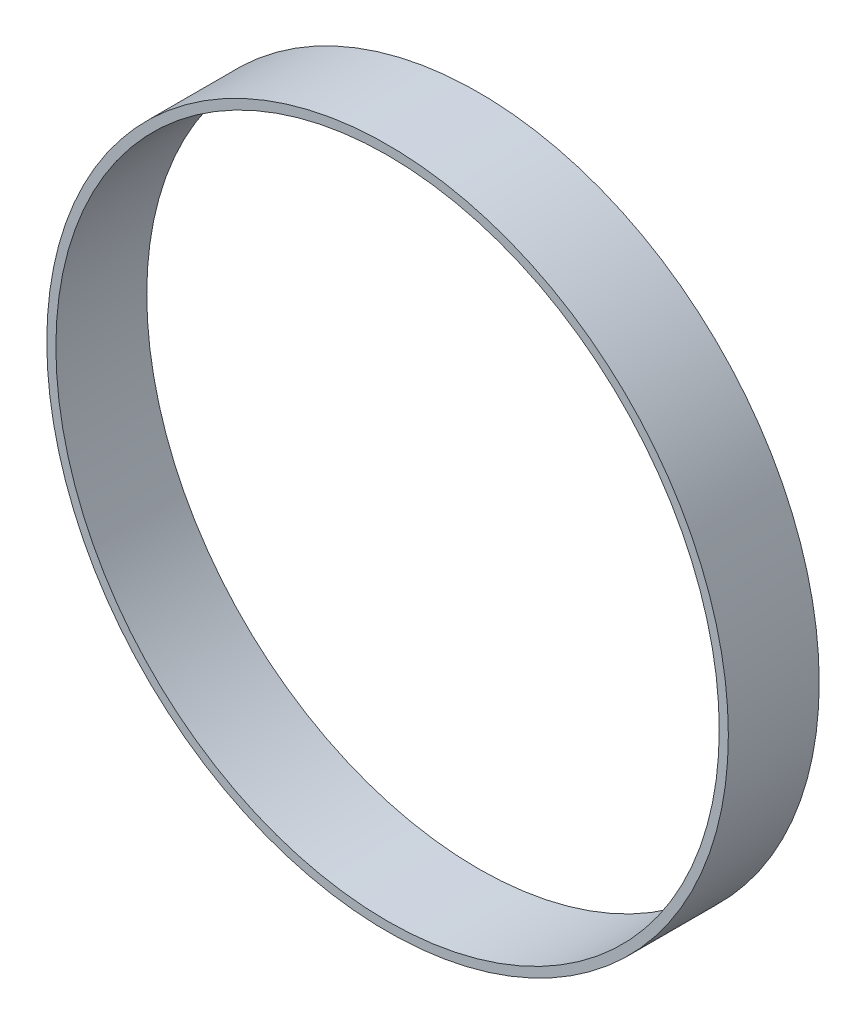
from build123d import *

# Parameters (mm, degrees)
BOSS_EXTRUDE1_DEPTH      = 10
BOSS_EXTRUDE1_DEPTH_BACK = 10
SKETCH1_R                = 75
SKETCH1_R_2              = 73


with BuildPart() as part:
    # Sketch1 → Boss-Extrude1 (new, two sides: drawn at the far end of the back side and taken through both)
    with BuildSketch(Plane.XY.offset(-BOSS_EXTRUDE1_DEPTH_BACK)):
        Circle(SKETCH1_R)
        Circle(SKETCH1_R_2, mode=Mode.SUBTRACT)
    extrude(amount=BOSS_EXTRUDE1_DEPTH + BOSS_EXTRUDE1_DEPTH_BACK)


solid = part.part
